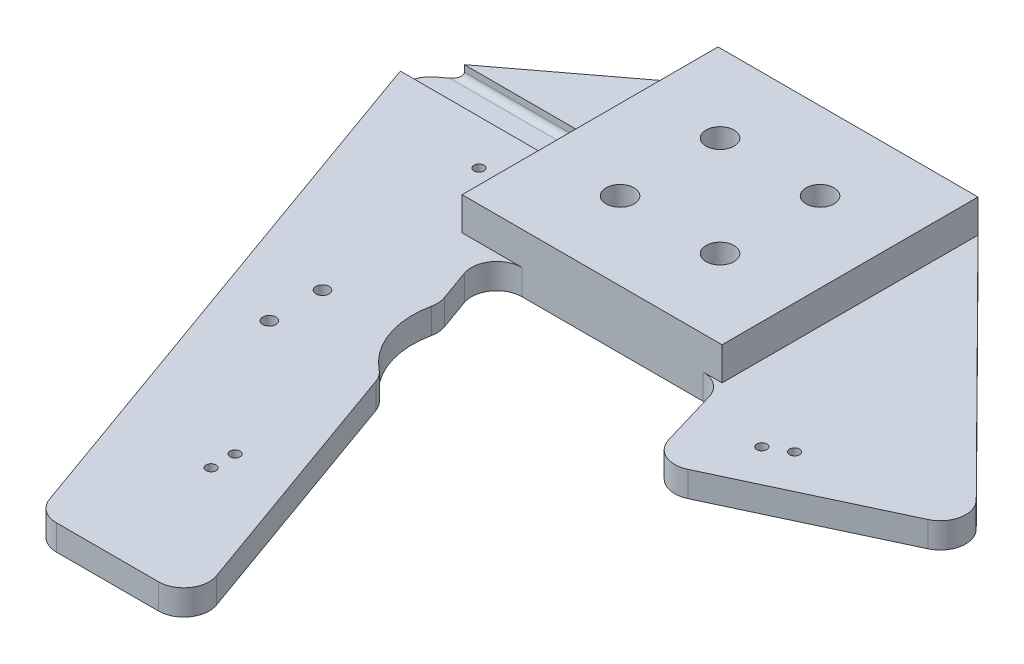
from build123d import *

# Parameters (mm, degrees)
SKETCH1_W                       = 65
SKETCH1_H                       = 64
EXTRUDE1_DEPTH                  = 8.255
EXTRUDE2_DEPTH                  = 6.35
FILLET1_R                       = 6.35
CBORE_FOR_M6_SBHCS1_D           = 7
CBORE_FOR_M6_SBHCS1_CBORE_D     = 11.5
CBORE_FOR_M6_SBHCS1_CBORE_DEPTH = 8.38
M3X0_5_TAPPED_HOLE1_D           = 2.5
M4X0_7_TAPPED_HOLE1_D           = 3.3
SKETCH10_W                      = 45.157529952
SKETCH10_H                      = 9.398
CUT_EXTRUDE1_DEPTH              = 3.175
FILLET2_R                       = 1.5875
SKETCH11_R                      = 20.588537239
CUT_EXTRUDE2_DEPTH              = 173.088346863
FILLET3_R                       = 6.35


with BuildPart() as part:
    # Sketch1 → Extrude1 (new body)
    with BuildSketch(Plane(origin=(0, 0, 0), x_dir=(1, 0, 0), z_dir=(0, 1, 0))):
        Rectangle(SKETCH1_W, SKETCH1_H)
    extrude(amount=EXTRUDE1_DEPTH)

    # Sketch3 → Extrude2 (add)
    with BuildSketch(Plane.XZ):
        Polygon((-32.5, -32), (-76.484147351, 1.251326619), (-24.877631504, 145.512128668), (14.112838434, 145.512128668), (-26.493933355, 32), (32.5, 32), (40.26552936, 58.115798324), (96.00808235, 32), (32.5, -32), align=None)
    extrude(amount=EXTRUDE2_DEPTH)

    # Fillet1
    fillet1_edges = [part.edges().sort_by_distance(p)[0] for p in [
        (96.00808235, -3.175, 32),
        (40.26552936, -3.175, 58.115798324),
        (32.5, -3.175, 32),
        (-26.493933355, -3.175, 32),
        (-76.484147351, -3.175, 1.251326619),
        (-24.877631504, -3.175, 145.512128668),
        (14.112838434, -3.175, 145.512128668),
    ]]
    fillet(fillet1_edges, radius=FILLET1_R)

    # CBORE for M6 SBHCS1 (through all)
    with Locations(Plane.XZ.offset(6.35)):
        with Locations((-12.5, 12.5), (12.5, 12.5), (12.5, -12.5), (-12.5, -12.5)):
            CounterBoreHole(CBORE_FOR_M6_SBHCS1_D / 2, CBORE_FOR_M6_SBHCS1_CBORE_D / 2, CBORE_FOR_M6_SBHCS1_CBORE_DEPTH)

    # M3x0.5 Tapped Hole1 (through all)
    with Locations(Plane.XZ.offset(6.35)):
        with Locations((-12.991981474, 114.259500014), (-12.991981474, 108.259500014), (51.311236439, 40.865980186), (56.507388862, 37.865980186), (-39.204872739, 18.874519842), (-44.401025162, 15.874519842)):
            Hole(M3X0_5_TAPPED_HOLE1_D / 2)

    # M4x0.7 Tapped Hole1 (through all)
    with Locations(Plane(origin=(0, 0, 0), x_dir=(-1, 0, 0), z_dir=(0, 1, 0))):
        with Locations((37.535205925, 75.138578877), (37.535205925, 61.868858743)):
            Hole(M4X0_7_TAPPED_HOLE1_D / 2)

    # Sketch10 → Cut-Extrude1 (cut)
    with BuildSketch(Plane(origin=(0, 0, 0), x_dir=(1, 0, 0), z_dir=(0, 1, 0))):
        with Locations((-55.078764976, -0.003190653)):
            Rectangle(SKETCH10_W, SKETCH10_H)
    extrude(amount=-CUT_EXTRUDE1_DEPTH, mode=Mode.SUBTRACT)

    # Fillet2
    fillet2_edges = [part.edges().sort_by_distance(p)[0] for p in [
        (-50.558701218, -3.175, -4.695809347),
        (-32.5, -3.175, 0.003190653),
        (-32.5, -1.5875, -4.695809347),
        (-53.835070304, -3.175, 4.702190653),
        (-32.5, -1.5875, 4.702190653),
    ]]
    fillet(fillet2_edges, radius=FILLET2_R)

    # Sketch11 → Cut-Extrude2 (cut, through all)
    with BuildSketch(Plane(origin=(0, 0, 0), x_dir=(-1, 0, 0), z_dir=(0, 1, 0))):
        with Locations((0.295205925, 56.000000014)):
            Circle(SKETCH11_R)
    extrude(amount=-CUT_EXTRUDE2_DEPTH, mode=Mode.SUBTRACT)

    # Fillet3
    fillet3_edges = [part.edges().sort_by_distance(p)[0] for p in [
        (-20.019691254, -3.175, 50.098089803),
        (-11.80057866, -3.175, 73.07378881),
    ]]
    fillet(fillet3_edges, radius=FILLET3_R)


solid = part.part
